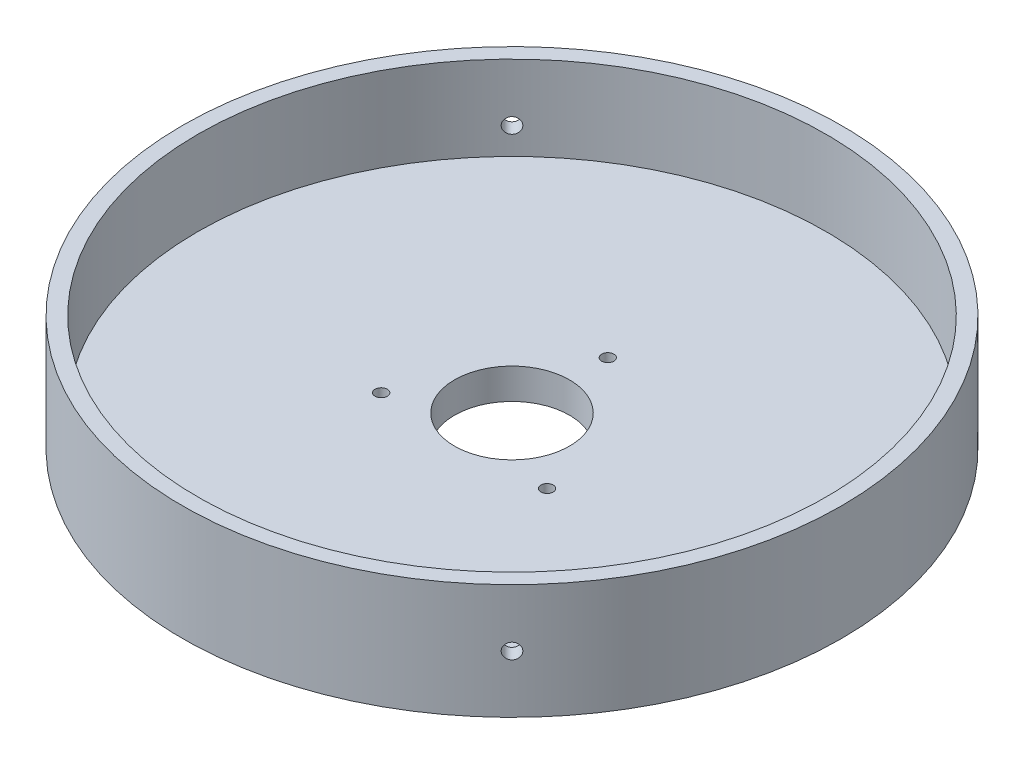
from build123d import *

# Parameters (mm, degrees)
SKETCH2_R          = 0.8
CUT_EXTRUDE1_DEPTH = 62.798058222
SKETCH3_R          = 1
CUT_EXTRUDE2_DEPTH = 63.633856659
CIRPATTERN1_COUNT  = 4


with BuildPart() as part:
    # Sketch1 → Revolve1 (revolve)
    with BuildSketch(Plane.XY, mode=Mode.PRIVATE) as revolve1_sk:
        Polygon((7.5, 4), (7.5, 0), (43, 0), (43, 15), (41, 15), (41, 4), align=None)
    revolve(revolve1_sk.sketch.rotate(Axis((0, 4, 0), (0, -1, 0)), 180), axis=Axis((0, 4, 0), (0, -1, 0)))

    # Sketch2 → Cut-Extrude1 (cut, through all)
    with BuildSketch(Plane(origin=(0, 4, 0), x_dir=(1, 0, 0), z_dir=(0, 1, 0))):
        with Locations(Location((0, 12.5, 0), (0, 0, 180))):
            Circle(SKETCH2_R)
        with Locations(Location((10.825317547, -6.25, 0), (0, 0, 180))):
            Circle(SKETCH2_R)
        with Locations(Location((-10.825317547, -6.25, 0), (0, 0, 180))):
            Circle(SKETCH2_R)
    extrude(amount=-CUT_EXTRUDE1_DEPTH, mode=Mode.SUBTRACT)

    # Sketch3 → Cut-Extrude2 (cut, through all)
    with BuildSketch(Plane(origin=(0, 0, 0), x_dir=(0.7071067811865464, 0, 0.7071067811865488), z_dir=(-0.7071067811865488, 0, 0.7071067811865464))):
        with Locations((0, 7.5)):
            Circle(SKETCH3_R)
    cut_extrude2 = extrude(amount=-CUT_EXTRUDE2_DEPTH, mode=Mode.SUBTRACT)

    # CirPattern1: Cut-Extrude2 ×4 about axis
    cirpattern1_axis = Axis((0, 4, 0), (0, 1, 0))
    for i in range(1, CIRPATTERN1_COUNT):
        add(cut_extrude2.rotate(cirpattern1_axis, i * 360 / CIRPATTERN1_COUNT), mode=Mode.SUBTRACT)


solid = part.part
